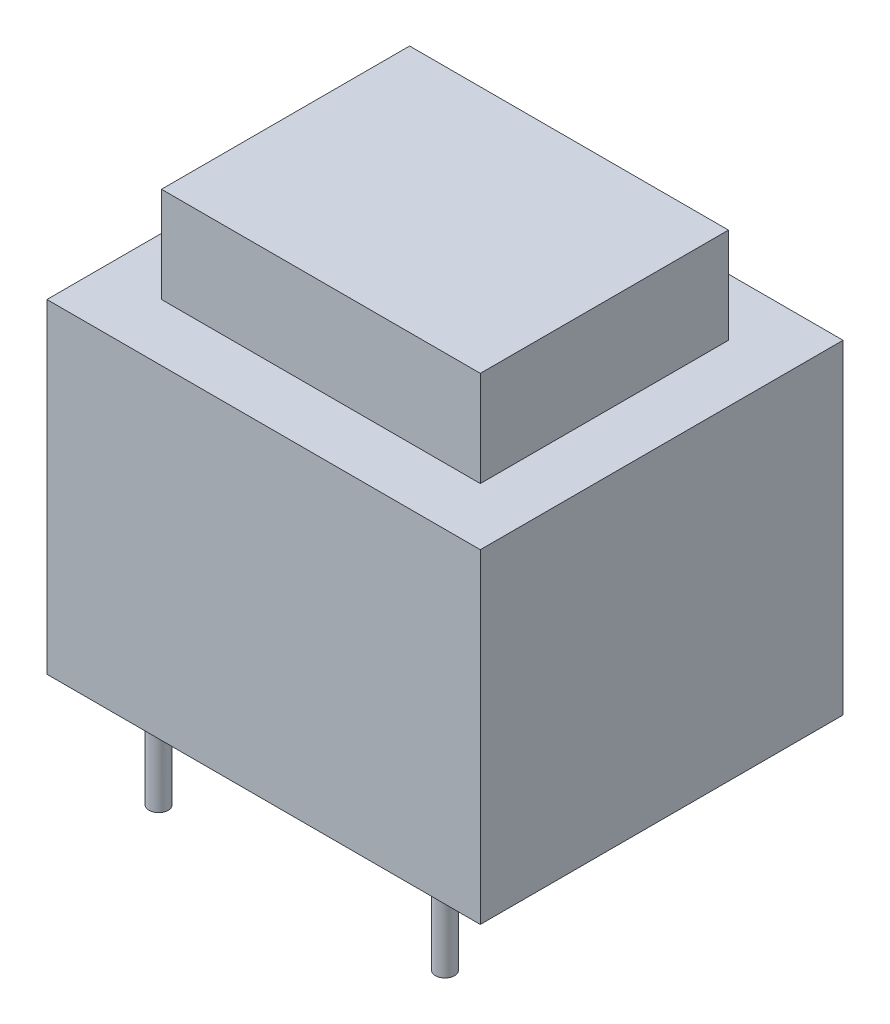
from build123d import *

# Parameters (mm, degrees)
SKETCH2_W           = 22.7
SKETCH2_H           = 22
BOSS_EXTRUDE1_DEPTH = 19
SKETCH3_R           = 0.5
BOSS_EXTRUDE2_DEPTH = 5
SKETCH5_W           = 22.7
SKETCH5_H           = 19
SKETCH5_W_2         = 16.7
SKETCH5_H_2         = 12.996403956
CUT_EXTRUDE1_DEPTH  = 5


with BuildPart() as part:
    # Sketch2 → Boss-Extrude1 (new body)
    with BuildSketch(Plane.XY):
        with Locations((11.35, -11)):
            Rectangle(SKETCH2_W, SKETCH2_H)
    extrude(amount=BOSS_EXTRUDE1_DEPTH)

    # Sketch3 → Boss-Extrude2 (add)
    with BuildSketch(Plane.XZ.offset(22)):
        with Locations(Location((18.85, 17, 0), (0, 0, 90))):
            Circle(SKETCH3_R)
        with Locations(Location((3.85, 17, 0), (0, 0, 90))):
            Circle(SKETCH3_R)
        with Locations(Location((8.85, 2, 0), (0, 0, 90))):
            Circle(SKETCH3_R)
        with Locations(Location((13.85, 2, 0), (0, 0, 90))):
            Circle(SKETCH3_R)
    extrude(amount=BOSS_EXTRUDE2_DEPTH)

    # Sketch5 → Cut-Extrude1 (cut)
    with BuildSketch(Plane(origin=(0, 0, 0), x_dir=(1, 0, 0), z_dir=(0, 1, 0))):
        with Locations((11.35, -9.5)):
            Rectangle(SKETCH5_W, SKETCH5_H)
        with Locations((11.35, -9.501798022)):
            Rectangle(SKETCH5_W_2, SKETCH5_H_2, mode=Mode.SUBTRACT)
    extrude(amount=-CUT_EXTRUDE1_DEPTH, mode=Mode.SUBTRACT)


solid = part.part
